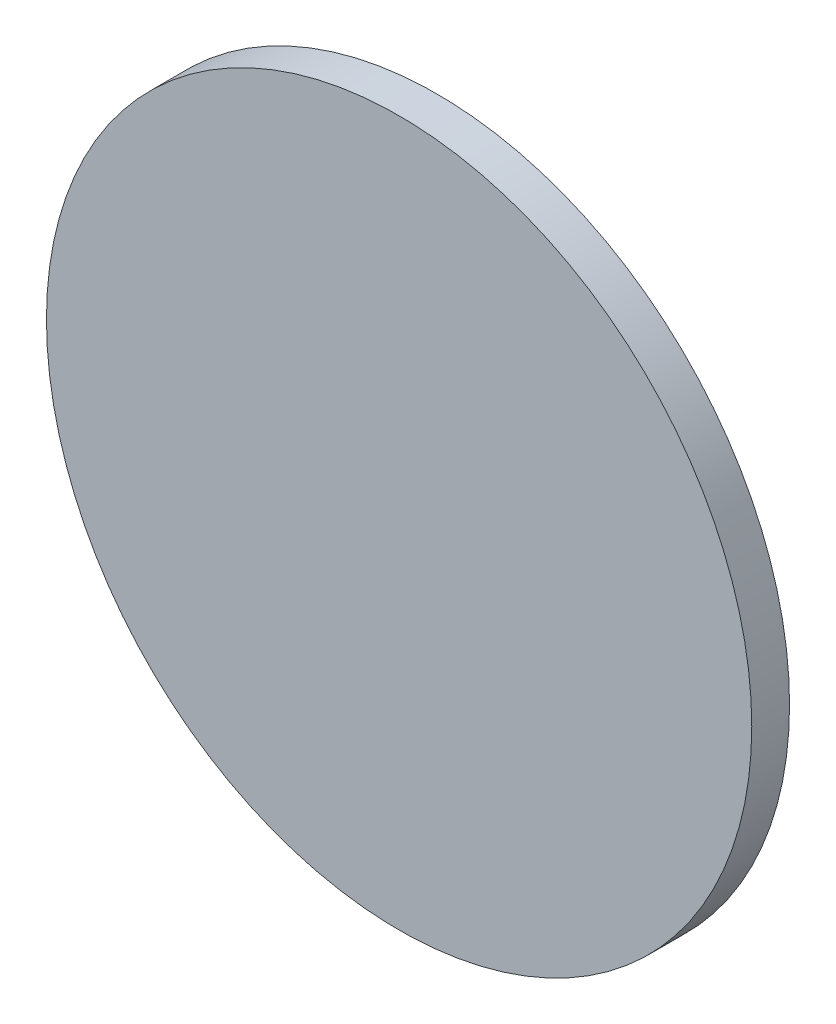
from build123d import *

# Parameters (mm, degrees)
SKETCH1_R           = 177.8
BOSS_EXTRUDE1_DEPTH = 19.05


with BuildPart() as part:
    # Sketch1 → Boss-Extrude1 (new body)
    with BuildSketch(Plane.XY):
        with Locations(Location((0, 0, 0), (0, 0, 180))):
            Circle(SKETCH1_R)
    extrude(amount=BOSS_EXTRUDE1_DEPTH)


solid = part.part
